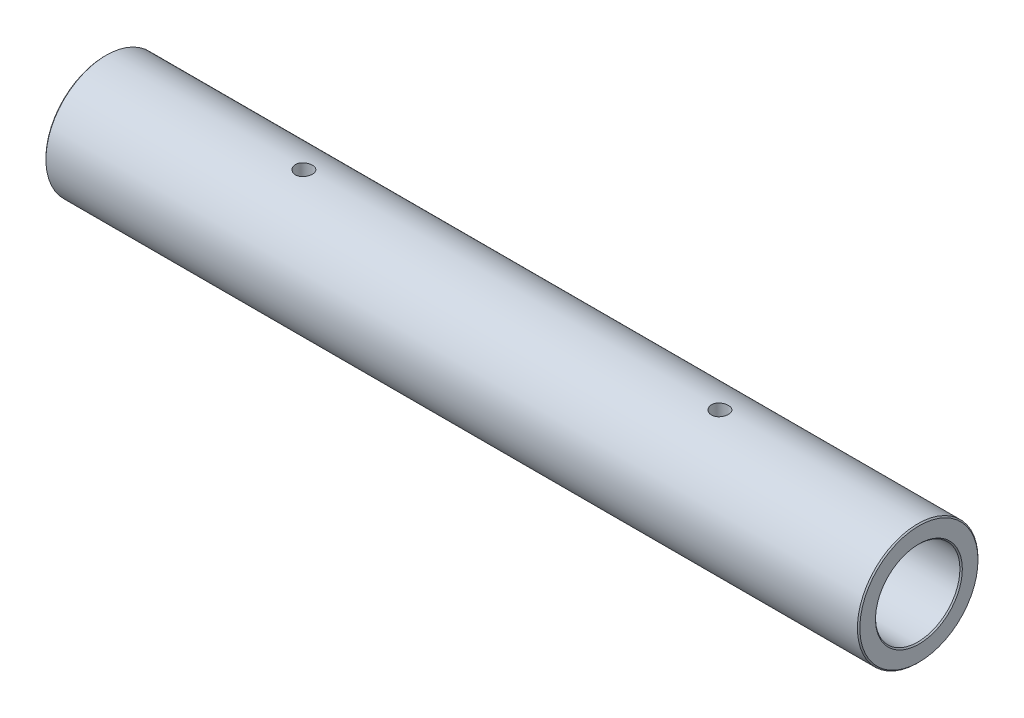
from build123d import *

# Parameters (mm, degrees)
SKETCH_1_R              = 50
SKETCH_1_R_2            = 35
EXTRUDE_1_DEPTH         = 337.5
CHAMFER_1_SIZE          = 1
HOLE_WIZARD_M16_1_D     = 14
HOLE_WIZARD_M16_1_DEPTH = 42
HOLE_WIZARD_M16_1_TIP   = 4.206024333


with BuildPart() as part:
    # 草图1 → 凸台-拉伸1 (new, symmetric)
    with BuildSketch(Plane(origin=(0, 0, 0), x_dir=(0, 0, -1), z_dir=(1, 0, 0))):
        Circle(SKETCH_1_R)
        Circle(SKETCH_1_R_2, mode=Mode.SUBTRACT)
    extrude(amount=EXTRUDE_1_DEPTH, both=True)

    # 倒角1
    chamfer_1_edges = [part.edges().sort_by_distance(p)[0] for p in [
        (-337.5, 0, 50),
        (337.5, 0, 50),
        (-337.5, 0, 35),
        (337.5, 0, 35),
    ]]
    chamfer(chamfer_1_edges, length=CHAMFER_1_SIZE)

    # M16 螺纹孔1
    with Locations(Plane(origin=(0, 50, 0), x_dir=(1, 0, 0), z_dir=(0, 1, 0))):
        with Locations((172.5, 0), (-172.5, 0)):
            Hole(HOLE_WIZARD_M16_1_D / 2, depth=HOLE_WIZARD_M16_1_DEPTH)
            with Locations((0, 0, -(HOLE_WIZARD_M16_1_DEPTH + HOLE_WIZARD_M16_1_TIP / 2))):  # 118° drill point
                Cone(0, HOLE_WIZARD_M16_1_D / 2, HOLE_WIZARD_M16_1_TIP, mode=Mode.SUBTRACT)


solid = part.part
